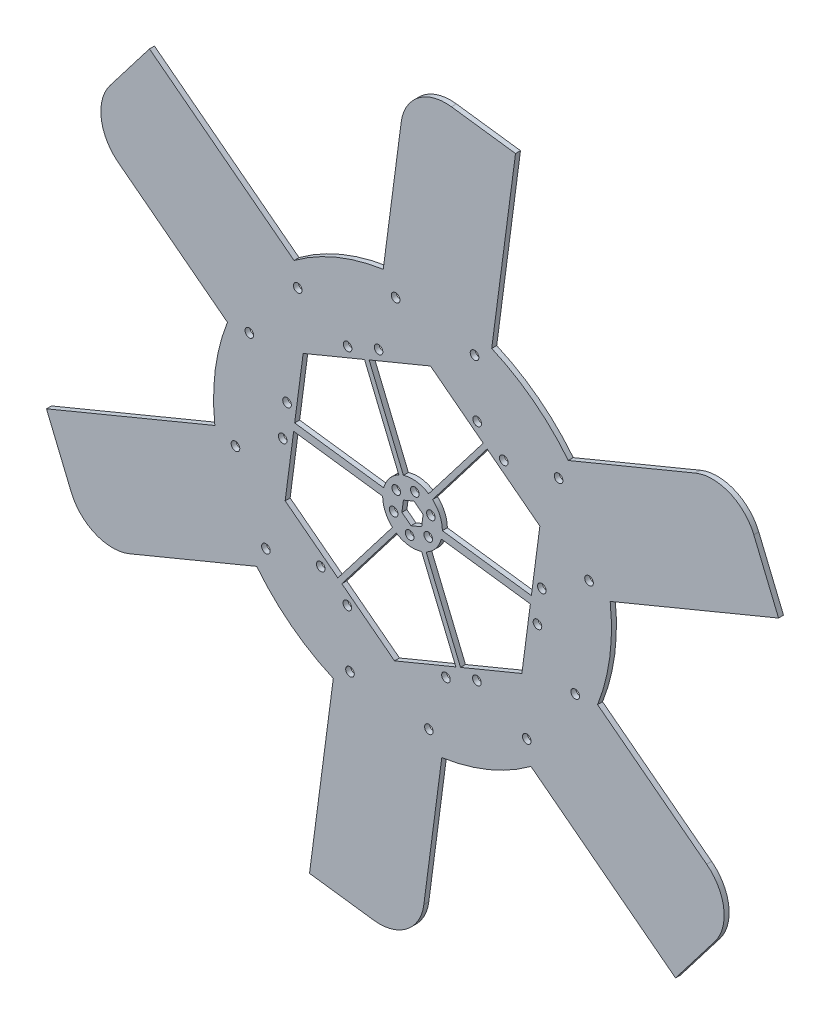
from build123d import *

# Parameters (mm, degrees)
SKETCH1_R            = 127
BOSS_EXTRUDE1_DEPTH  = 3.175
M5_CLEARANCE_HOLE1_D = 5.5
CIRPATTERN1_COUNT    = 6
BOSS_EXTRUDE2_DEPTH  = 3.175
CIRPATTERN2_COUNT    = 6
CUT_EXTRUDE1_REACH   = 335.168
CUT_EXTRUDE2_DEPTH   = 334.167593846


with BuildPart() as part:
    # Sketch1 → Boss-Extrude1 (new body)
    with BuildSketch(Plane.XY):
        Circle(SKETCH1_R)
    extrude(amount=BOSS_EXTRUDE1_DEPTH)

    # M5 Clearance Hole1 (through all)
    with Locations(Plane(origin=(0, 0, 0), x_dir=(-1, 0, 0), z_dir=(0, 0, -1))):
        with Locations((-58.2494214, 58.493652703), (-82.549819355, -0.172697611), (-93.238867767, 66.113565457), (-112.679186132, 19.180485205), (-11.733270063, 4.860079591)):
            m5_clearance_hole1 = Hole(M5_CLEARANCE_HOLE1_D / 2)

    # CirPattern1: M5 Clearance Hole1 ×6 about axis
    cirpattern1_axis = Axis((-0.168463788, -0.069779986, 0), (0, 0, 1))
    for i in range(1, CIRPATTERN1_COUNT):
        add(m5_clearance_hole1.rotate(cirpattern1_axis, i * 360 / CIRPATTERN1_COUNT), mode=Mode.SUBTRACT)

    # Sketch6 → Boss-Extrude2 (add)
    with BuildSketch(Plane(origin=(0, 0, 0), x_dir=(-1, 0, 0), z_dir=(0, 0, -1))):
        with BuildLine():
            Line((-92.527543442, 76.128710982), (-180.527068914, 112.579307915))
            ThreePointArc((-180.527068914, 112.579307915), (-202.397427074, 112.579307915), (-217.862105635, 97.114629353))
            Line((-217.862105635, 97.114629353), (-233.657364306, 58.981501649))
            Line((-233.657364306, 58.981501649), (-119.257981193, 11.595725636))
            Line((-119.257981193, 11.595725636), (-92.527543442, 76.128710982))
        make_face()
    boss_extrude2 = extrude(amount=-BOSS_EXTRUDE2_DEPTH)

    # CirPattern2: Boss-Extrude2 ×6 about axis
    cirpattern2_axis = Axis((0, 0, 0), (0, 0, 1))
    for i in range(1, CIRPATTERN2_COUNT):
        add(boss_extrude2.rotate(cirpattern2_axis, i * 360 / CIRPATTERN2_COUNT))

    # Sketch7 → Cut-Extrude1 (cut, up to next)
    with BuildSketch(Plane.XY, mode=Mode.PRIVATE) as cut_extrude1_sk1:
        with BuildLine():
            Line((-30.627136304, 69.792110428), (-69.805717322, 53.563810816))
            Line((-69.805717322, 53.563810816), (-75.223541932, 12.411347252))
            Line((-75.223541932, 12.411347252), (-18.400886991, 4.930502809))
            ThreePointArc((-18.400886991, 4.930502809), (-14.833899914, 11.952318325), (-8.731421131, 16.931177899))
            Line((-8.731421131, 16.931177899), (-30.627136304, 69.792110428))
        make_face()
    cut_extrude1_tool1 = extrude(cut_extrude1_sk1.sketch, amount=CUT_EXTRUDE1_REACH, mode=Mode.PRIVATE) & part.part
    # Sketch7 → Cut-Extrude1 (cut, up to next)
    with BuildSketch(Plane.XY, mode=Mode.PRIVATE) as cut_extrude1_sk2:
        with BuildLine():
            Line((81.290479551, 33.671619122), (47.647069318, 59.487115762))
            Line((47.647069318, 59.487115762), (12.816016466, 14.094403923))
            ThreePointArc((12.816016466, 14.094403923), (17.421934647, 7.705757144), (19.05, 0))
            Line((19.05, 0), (75.872654941, -7.480844443))
            Line((75.872654941, -7.480844443), (81.290479551, 33.671619122))
        make_face()
    cut_extrude1_tool2 = extrude(cut_extrude1_sk2.sketch, amount=CUT_EXTRUDE1_REACH, mode=Mode.PRIVATE) & part.part
    # Sketch7 → Cut-Extrude1 (cut, up to next)
    with BuildSketch(Plane.XY, mode=Mode.PRIVATE) as cut_extrude1_sk3:
        with BuildLine():
            Line((11.484762229, 87.235429938), (-27.693818788, 71.007130326))
            Line((-27.693818788, 71.007130326), (-5.798103615, 18.146197797))
            ThreePointArc((-5.798103615, 18.146197797), (2.486523962, 18.887024609), (10.297119611, 16.02722146))
            Line((10.297119611, 16.02722146), (45.128172463, 61.419933299))
            Line((45.128172463, 61.419933299), (11.484762229, 87.235429938))
        make_face()
    cut_extrude1_tool3 = extrude(cut_extrude1_sk3.sketch, amount=CUT_EXTRUDE1_REACH, mode=Mode.PRIVATE) & part.part
    # Sketch7 → Cut-Extrude1 (cut, up to next)
    with BuildSketch(Plane.XY, mode=Mode.PRIVATE) as cut_extrude1_sk4:
        with BuildLine():
            Line((-81.290479551, -33.671619122), (-47.647069318, -59.487115762))
            Line((-47.647069318, -59.487115762), (-12.816016466, -14.094403923))
            ThreePointArc((-12.816016466, -14.094403923), (-17.421934647, -7.705757144), (-19.05, 0))
            Line((-19.05, 0), (-75.872654941, 7.480844443))
            Line((-75.872654941, 7.480844443), (-81.290479551, -33.671619122))
        make_face()
    cut_extrude1_tool4 = extrude(cut_extrude1_sk4.sketch, amount=CUT_EXTRUDE1_REACH, mode=Mode.PRIVATE) & part.part
    # Sketch7 → Cut-Extrude1 (cut, up to next)
    with BuildSketch(Plane.XY, mode=Mode.PRIVATE) as cut_extrude1_sk5:
        with BuildLine():
            Line((-11.484762229, -87.235429938), (27.693818788, -71.007130326))
            Line((27.693818788, -71.007130326), (5.798103615, -18.146197797))
            ThreePointArc((5.798103615, -18.146197797), (-2.486523962, -18.887024609), (-10.297119611, -16.02722146))
            Line((-10.297119611, -16.02722146), (-45.128172463, -61.419933299))
            Line((-45.128172463, -61.419933299), (-11.484762229, -87.235429938))
        make_face()
    cut_extrude1_tool5 = extrude(cut_extrude1_sk5.sketch, amount=CUT_EXTRUDE1_REACH, mode=Mode.PRIVATE) & part.part
    # Sketch7 → Cut-Extrude1 (cut, up to next)
    with BuildSketch(Plane.XY, mode=Mode.PRIVATE) as cut_extrude1_sk6:
        with BuildLine():
            Line((69.805717322, -53.563810816), (75.223541932, -12.411347252))
            Line((75.223541932, -12.411347252), (18.400886991, -4.930502809))
            ThreePointArc((18.400886991, -4.930502809), (14.833899914, -11.952318325), (8.731421131, -16.931177899))
            Line((8.731421131, -16.931177899), (30.627136304, -69.792110428))
            Line((30.627136304, -69.792110428), (69.805717322, -53.563810816))
        make_face()
    cut_extrude1_tool6 = extrude(cut_extrude1_sk6.sketch, amount=CUT_EXTRUDE1_REACH, mode=Mode.PRIVATE) & part.part
    add(cut_extrude1_tool1.solids().sort_by_distance((-43.105306, 33.563643, 0))[0], mode=Mode.SUBTRACT)
    add(cut_extrude1_tool2.solids().sort_by_distance((50.323438, 21.263515, 0))[0], mode=Mode.SUBTRACT)
    add(cut_extrude1_tool3.solids().sort_by_distance((7.102658, 53.950047, 0))[0], mode=Mode.SUBTRACT)
    add(cut_extrude1_tool4.solids().sort_by_distance((-50.323438, -21.263515, 0))[0], mode=Mode.SUBTRACT)
    add(cut_extrude1_tool5.solids().sort_by_distance((-7.102658, -53.950047, 0))[0], mode=Mode.SUBTRACT)
    add(cut_extrude1_tool6.solids().sort_by_distance((43.105306, -33.563643, 0))[0], mode=Mode.SUBTRACT)

    # Sketch16 → Cut-Extrude2 (cut, through all)
    with BuildSketch(Plane.XY.offset(3.175)):
        Polygon((6.774206629, 2.80596826), (0.957063519, 7.269619162), (-5.81714311, 4.463650901), (-6.774206629, -2.80596826), (-0.957063519, -7.269619162), (5.81714311, -4.463650901), align=None)
    extrude(amount=-CUT_EXTRUDE2_DEPTH, mode=Mode.SUBTRACT)


solid = part.part
